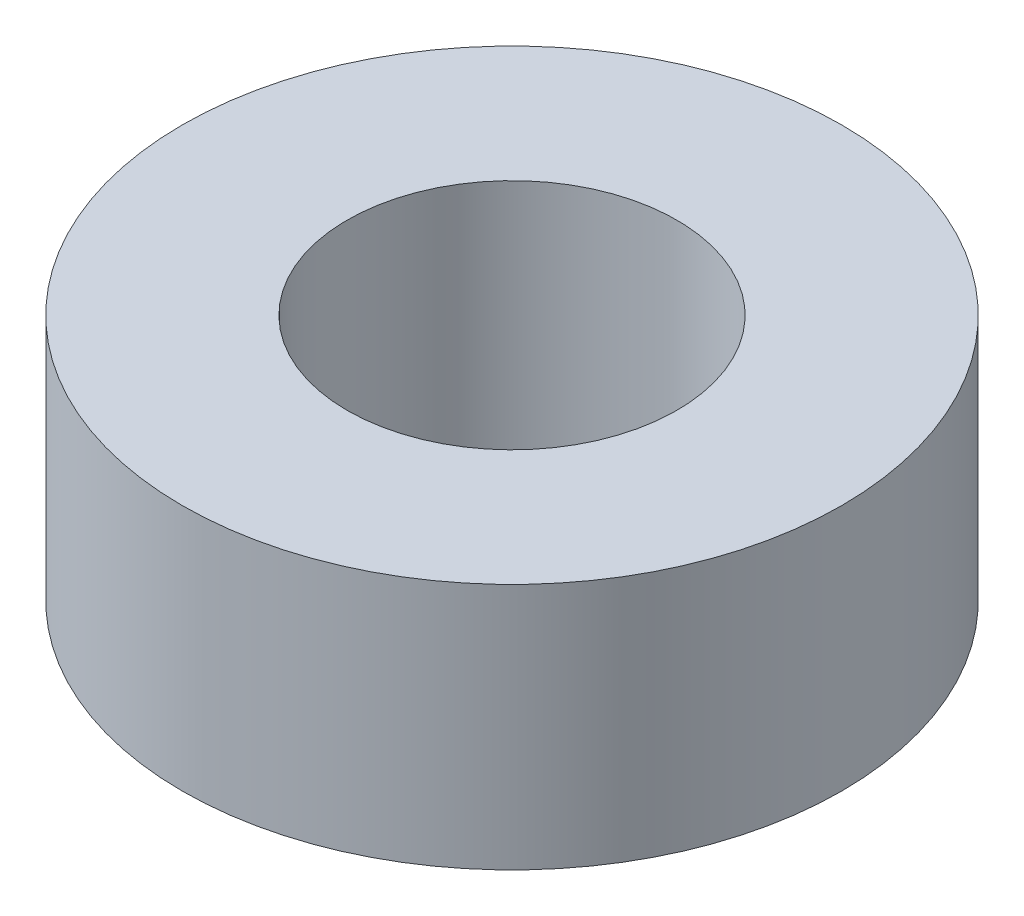
from build123d import *

# Parameters (mm, degrees)
SKETCH1_R           = 20
SKETCH1_R_2         = 10
BOSS_EXTRUDE1_DEPTH = 15


with BuildPart() as part:
    # Sketch1 → Boss-Extrude1 (new body)
    with BuildSketch(Plane(origin=(0, 0, 0), x_dir=(1, 0, 0), z_dir=(0, 1, 0))):
        with Locations(Location((0, 0, 0), (0, 0, 270))):
            Circle(SKETCH1_R)
        with Locations(Location((0, 0, 0), (0, 0, 270))):
            Circle(SKETCH1_R_2, mode=Mode.SUBTRACT)
    extrude(amount=BOSS_EXTRUDE1_DEPTH)


solid = part.part
